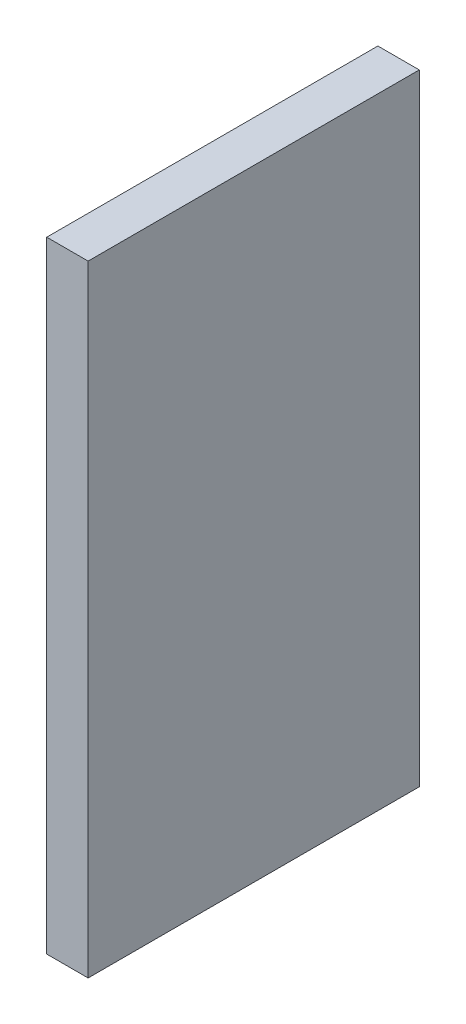
from build123d import *

# Parameters (mm, degrees)
ESQUISSE1_W      = 1
ESQUISSE1_H      = 15
EXTRUSION1_DEPTH = 8


with BuildPart() as part:
    # Esquisse1 → Extrusion1 (new body)
    with BuildSketch(Plane.XY):
        with Locations((2, 17.807050033)):
            Rectangle(ESQUISSE1_W, ESQUISSE1_H)
    extrude(amount=-EXTRUSION1_DEPTH)


solid = part.part
